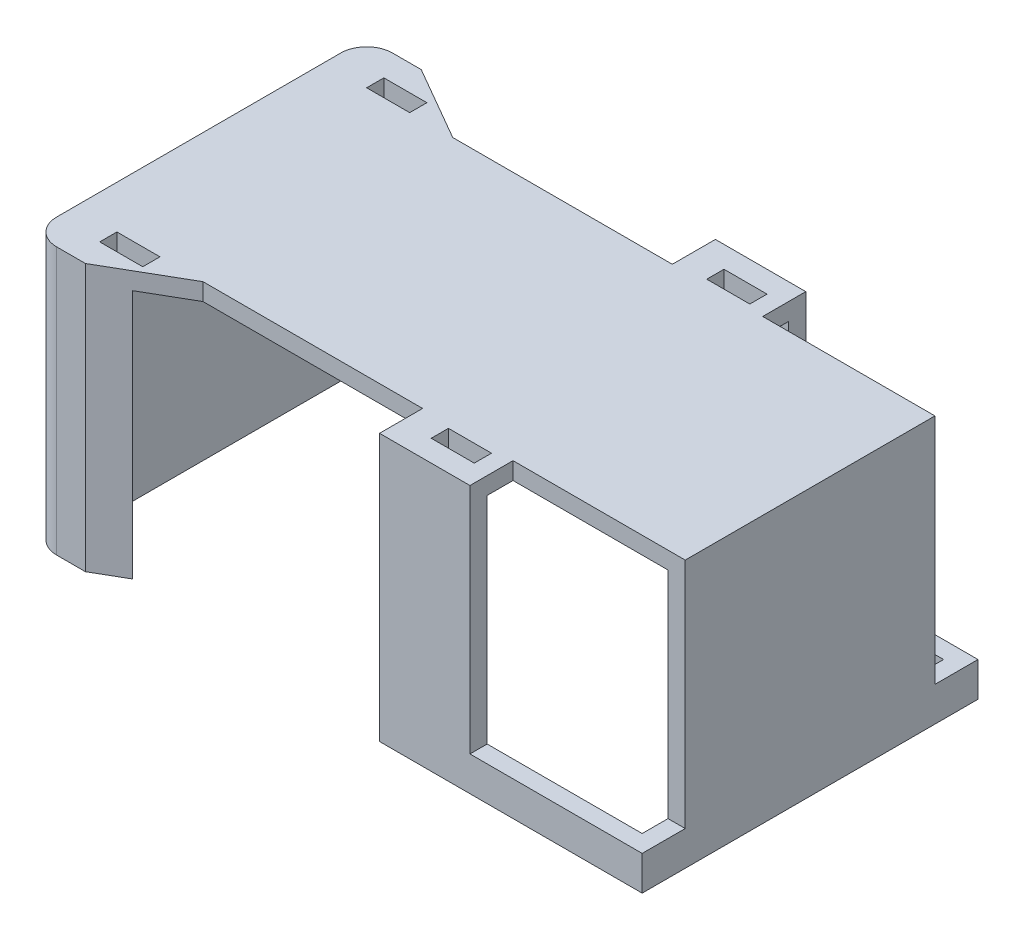
from build123d import *

# Parameters (mm, degrees)
SKETCH1_W           = 71
SKETCH1_H           = 39
BOSS_EXTRUDE1_DEPTH = 31
SHELL1_T            = -2
CUT_EXTRUDE1_DEPTH  = 52.004901725
SKETCH4_W           = 20
SKETCH4_H           = 5
CUT_EXTRUDE2_DEPTH  = 27
SKETCH5_W           = 5
SKETCH5_H           = 2
CUT_EXTRUDE3_DEPTH  = 52.004901725
FILLET2_R           = 3


with BuildPart() as part:
    # Sketch1 → Boss-Extrude1 (new body)
    with BuildSketch(Plane(origin=(0, 0, 0), x_dir=(1, 0, 0), z_dir=(0, 1, 0))):
        Rectangle(SKETCH1_W, SKETCH1_H)
    extrude(amount=BOSS_EXTRUDE1_DEPTH)

    # Shell1
    shell1_openings = [part.faces().sort_by_distance(p)[0] for p in [
        (0, 0, 0),
    ]]
    offset(amount=SHELL1_T, openings=shell1_openings, kind=Kind.INTERSECTION)

    # Sketch2 → Cut-Extrude1 (cut, through all)
    with BuildSketch(Plane(origin=(0, 31, 0), x_dir=(1, 0, 0), z_dir=(0, 1, 0))):
        Polygon((-29.160254038, 19.5), (5, 19.5), (5, 14.5), (-20.5, 14.5), align=None)
        Polygon((-20.5, -14.5), (5, -14.5), (5, -19.5), (-29.160254038, -19.5), align=None)
    extrude(amount=-CUT_EXTRUDE1_DEPTH, mode=Mode.SUBTRACT)

    # Sketch4 → Cut-Extrude2 (cut)
    with BuildSketch(Plane(origin=(0, 31, -31), x_dir=(1, 0, 0), z_dir=(0, -1, 0))):
        with Locations((25.5, 48)):
            Rectangle(SKETCH4_W, SKETCH4_H)
        with Locations((25.5, 14)):
            Rectangle(SKETCH4_W, SKETCH4_H)
    extrude(amount=CUT_EXTRUDE2_DEPTH, mode=Mode.SUBTRACT)

    # Sketch5 → Cut-Extrude3 (cut, through all)
    with BuildSketch(Plane(origin=(0, 31, 0), x_dir=(1, 0, 0), z_dir=(0, 1, 0))):
        with Locations((-28, 15.5)):
            Rectangle(SKETCH5_W, SKETCH5_H)
        with Locations((11, 16)):
            Rectangle(SKETCH5_W, SKETCH5_H)
        with Locations((11, -16)):
            Rectangle(SKETCH5_W, SKETCH5_H)
        with Locations((-28, -15.5)):
            Rectangle(SKETCH5_W, SKETCH5_H)
    extrude(amount=-CUT_EXTRUDE3_DEPTH, mode=Mode.SUBTRACT)

    # Fillet2
    fillet2_edges = [part.edges().sort_by_distance(p)[0] for p in [
        (-35.5, 15.5, 19.5),
        (-35.5, 15.5, -19.5),
    ]]
    fillet(fillet2_edges, radius=FILLET2_R)


solid = part.part
